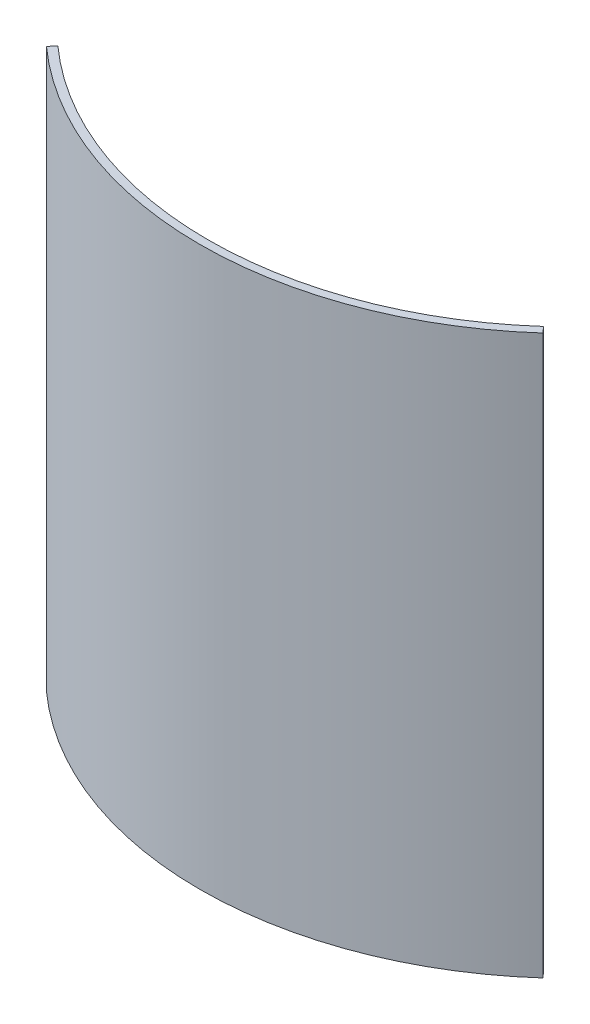
from build123d import *

# Parameters (mm, degrees)
BOSS_EXTRUDE1_START = -100
BOSS_EXTRUDE1_DEPTH = 690


with BuildPart() as part:
    # Sketch1 → Boss-Extrude1 (new body)
    with BuildSketch(Plane.XZ.offset(1400).offset(BOSS_EXTRUDE1_START)):
        with BuildLine():
            Line((-306.666666667, 342.86375655), (-300, 335.410196625))
            ThreePointArc((-300, 335.410196625), (0, 450), (300, 335.410196625))
            Line((300, 335.410196625), (306.666666667, 342.86375655))
            ThreePointArc((306.666666667, 342.86375655), (0, 460), (-306.666666667, 342.86375655))
        make_face()
    extrude(amount=-BOSS_EXTRUDE1_DEPTH)


solid = part.part
